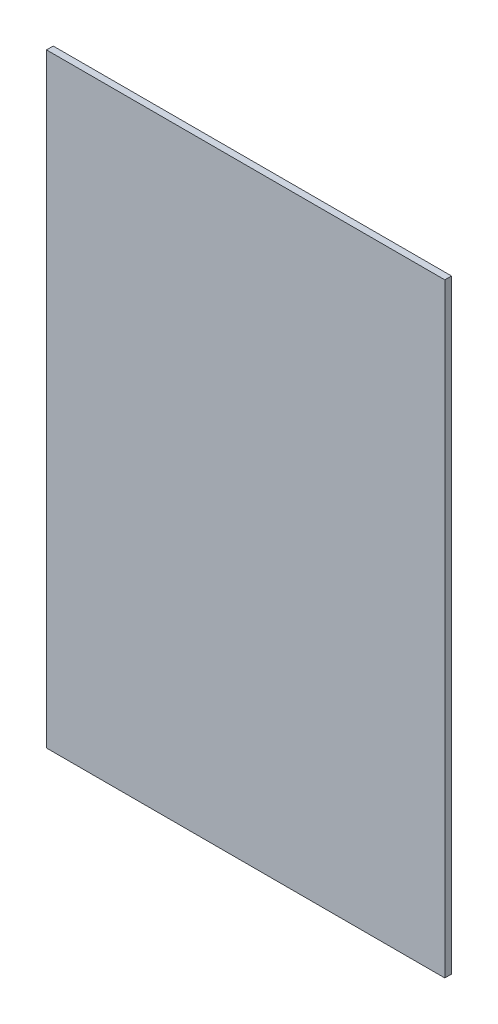
from build123d import *

# Parameters (mm, degrees)
SKETCH1_W          = 415
SKETCH1_H          = 630
BASE_EXTRUDE_DEPTH = 7
SKETCH19_W         = 298.8
SKETCH19_H         = 513.8
SKETCH19_W_2       = 164.4
SKETCH19_H_2       = 379.4
CUT_EXTRUDE1_DEPTH = 5
CHAMFER1_SIZE      = 4


with BuildPart() as part:
    # Sketch1 → Base-Extrude (new body)
    with BuildSketch(Plane.XY):
        with Locations((207.5, 315)):
            Rectangle(SKETCH1_W, SKETCH1_H)
    extrude(amount=BASE_EXTRUDE_DEPTH)

    # Sketch19 → Cut-Extrude1 (cut)
    with BuildSketch(Plane(origin=(0, 0, 0), x_dir=(-1, 0, 0), z_dir=(0, 0, -1))):
        with Locations((-207.5, 315)):
            Rectangle(SKETCH19_W, SKETCH19_H)
        with Locations((-207.5, 315)):
            Rectangle(SKETCH19_W_2, SKETCH19_H_2, mode=Mode.SUBTRACT)
    extrude(amount=-CUT_EXTRUDE1_DEPTH, mode=Mode.SUBTRACT)

    # Chamfer1
    chamfer1_edges = [part.edges().sort_by_distance(p)[0] for p in [
        (207.5, 58.1, 5),
        (356.9, 315, 5),
        (207.5, 571.9, 5),
        (58.1, 315, 5),
        (289.7, 315, 5),
        (207.5, 125.3, 5),
        (125.3, 315, 5),
        (207.5, 504.7, 5),
    ]]
    chamfer(chamfer1_edges, length=CHAMFER1_SIZE)


solid = part.part
